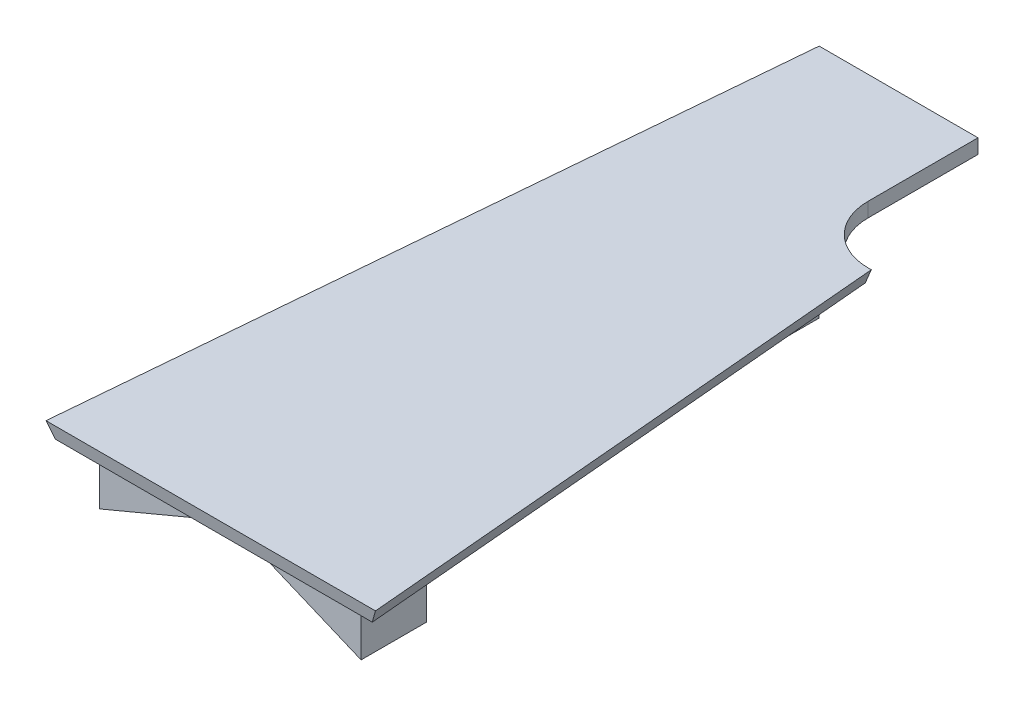
from build123d import *

# Parameters (mm, degrees)
SKIZZE1_W                            = 57
SKIZZE1_H                            = 123
AUFSATZ_LINEAR_AUSTRAGEN1_DEPTH      = 2.5
SCHNITT_LINEAR_AUSTRAGEN1_DEPTH      = 84.889808678
SCHNITT_LINEAR_AUSTRAGEN2_DEPTH      = 68.828828679
SCHNITT_LINEAR_AUSTRAGEN3_DEPTH      = 70.726045338
SCHNITT_LINEAR_AUSTRAGEN3_DEPTH_BACK = 70.726045338
SCHNITT_LINEAR_AUSTRAGEN4_DEPTH      = 70.47454308
SCHNITT_LINEAR_AUSTRAGEN4_DEPTH_BACK = 70.47454308
SKIZZE9_W                            = 45.241474544
SKIZZE9_H                            = 11.280630507
AUFSATZ_LINEAR_AUSTRAGEN2_DEPTH      = 13
SCHNITT_LINEAR_AUSTRAGEN5_DEPTH      = 20
SKIZZE12_W                           = 36.023643564
SKIZZE12_H                           = 10.472363364
AUFSATZ_LINEAR_AUSTRAGEN3_DEPTH      = 5
SCHNITT_LINEAR_AUSTRAGEN6_DEPTH      = 12
SCHNITT_LINEAR_AUSTRAGEN8_DEPTH      = 0.5
SCHNITT_LINEAR_AUSTRAGEN8_DEPTH_BACK = 1.65
SKIZZE16_R                           = 3.1
SCHNITT_LINEAR_AUSTRAGEN9_DEPTH      = 1.15
SCHNITT_LINEAR_AUSTRAGEN9_DEPTH_BACK = 1
SKIZZE17_R                           = 3.1
SCHNITT_LINEAR_AUSTRAGEN10_DEPTH     = 10


with BuildPart() as part:
    # Skizze1 → Aufsatz-Linear austragen1 (new body)
    with BuildSketch(Plane(origin=(0, 0, 0), x_dir=(1, 0, 0), z_dir=(0, 1, 0))):
        Rectangle(SKIZZE1_W, SKIZZE1_H)
    extrude(amount=AUFSATZ_LINEAR_AUSTRAGEN1_DEPTH)

    # Skizze2 → Schnitt-Linear austragen1 (cut, through all)
    with BuildSketch(Plane(origin=(28.5, 0, 0), x_dir=(0, 0, -1), z_dir=(1, 0, 0))):
        Polygon((-61.5, 2.5), (-61.5, 0), (-60.968608596, 0), align=None)
    extrude(amount=-SCHNITT_LINEAR_AUSTRAGEN1_DEPTH, mode=Mode.SUBTRACT)

    # Skizze3 → Schnitt-Linear austragen2 (cut, through all)
    with BuildSketch(Plane(origin=(0, 2.5, 0), x_dir=(1, 0, 0), z_dir=(0, 1, 0))):
        Polygon((-28.5, -61.5), (-17.738894386, 61.5), (-28.5, 61.5), align=None)
        Polygon((28.5, -61.5), (17.738894386, 61.5), (28.5, 61.5), align=None)
    extrude(amount=-SCHNITT_LINEAR_AUSTRAGEN2_DEPTH, mode=Mode.SUBTRACT)

    # Skizze5 → Schnitt-Linear austragen3 (cut, two sides: drawn at the far end of the back side and taken through both)
    with BuildSketch(Plane(origin=(0.175618176, 0, 2.007324937), x_dir=(0, -1, 0), z_dir=(0.08715574274765484, 0, 0.9961946980917459)).offset(-SCHNITT_LINEAR_AUSTRAGEN3_DEPTH_BACK)):
        Polygon((0.008562414, 23.031470717), (-2.5, 23.031470717), (0, 21.995936811), align=None)
    extrude(amount=SCHNITT_LINEAR_AUSTRAGEN3_DEPTH + SCHNITT_LINEAR_AUSTRAGEN3_DEPTH_BACK, mode=Mode.SUBTRACT)

    # Skizze6 → Schnitt-Linear austragen4 (cut, two sides: drawn at the far end of the back side and taken through both)
    with BuildSketch(Plane(origin=(-0.152372814, 0, 1.741629235), x_dir=(0, 1, 0), z_dir=(-0.08715574274766175, 0, 0.9961946980917452)).offset(-SCHNITT_LINEAR_AUSTRAGEN4_DEPTH_BACK)):
        Polygon((2.5, 23.031470717), (0, 21.995936811), (0, 23.031470717), align=None)
    extrude(amount=SCHNITT_LINEAR_AUSTRAGEN4_DEPTH + SCHNITT_LINEAR_AUSTRAGEN4_DEPTH_BACK, mode=Mode.SUBTRACT)

    # Skizze9 → Aufsatz-Linear austragen2 (add)
    with BuildSketch(Plane.XZ):
        with Locations((0, 52.468608596)):
            Rectangle(SKIZZE9_W, SKIZZE9_H)
    extrude(amount=AUFSATZ_LINEAR_AUSTRAGEN2_DEPTH)

    # Skizze11 → Schnitt-Linear austragen5 (cut)
    with BuildSketch(Plane(origin=(0, 0, 46.828293342), x_dir=(-1, 0, 0), z_dir=(0, 0, -1))):
        Polygon((-22.620737272, -9.484039906), (0, 0), (22.620737272, -9.484039906), (22.620737272, -13), (-22.620737272, -13), align=None)
    extrude(amount=-SCHNITT_LINEAR_AUSTRAGEN5_DEPTH, mode=Mode.SUBTRACT)

    # Skizze12 → Aufsatz-Linear austragen3 (add)
    with BuildSketch(Plane.XZ):
        with Locations((0, -20.5)):
            Rectangle(SKIZZE12_W, SKIZZE12_H)
    extrude(amount=AUFSATZ_LINEAR_AUSTRAGEN3_DEPTH)

    # Skizze13 → Schnitt-Linear austragen6 (cut)
    with BuildSketch(Plane(origin=(0, 0, -25.736181682), x_dir=(-1, 0, 0), z_dir=(0, 0, -1))):
        Polygon((-18.011821782, -2.5), (-7.183132097, 0), (7.183132097, 0), (18.011821782, -2.5), (18.011821782, -5), (-18.011821782, -5), align=None)
    extrude(amount=-SCHNITT_LINEAR_AUSTRAGEN6_DEPTH, mode=Mode.SUBTRACT)

    # Skizze16 → Schnitt-Linear austragen8 (cut, two sides: drawn at the far end of the back side and taken through both)
    with BuildSketch(Plane.XZ.offset(-SCHNITT_LINEAR_AUSTRAGEN8_DEPTH_BACK)):
        with Locations((12.59747694, -20.5)):
            Circle(SKIZZE16_R)
        with Locations((-12.59747694, -20.5)):
            Circle(SKIZZE16_R)
    extrude(amount=SCHNITT_LINEAR_AUSTRAGEN8_DEPTH + SCHNITT_LINEAR_AUSTRAGEN8_DEPTH_BACK, mode=Mode.SUBTRACT)

    # Skizze17 → Schnitt-Linear austragen9 (cut, two sides: drawn at the far end of the back side and taken through both)
    with BuildSketch(Plane(origin=(0, -4.742019953, 0), x_dir=(1, 0, 0), z_dir=(0, 1, 0)).offset(-SCHNITT_LINEAR_AUSTRAGEN9_DEPTH_BACK)):
        with Locations((-16.965552954, -52.468608596)):
            Circle(SKIZZE17_R)
        with Locations((16.965552954, -52.468608596)):
            Circle(SKIZZE17_R)
    extrude(amount=SCHNITT_LINEAR_AUSTRAGEN9_DEPTH + SCHNITT_LINEAR_AUSTRAGEN9_DEPTH_BACK, mode=Mode.SUBTRACT)

    # Skizze18 → Schnitt-Linear austragen10 (cut)
    with BuildSketch(Plane(origin=(0, 2.5, 0), x_dir=(1, 0, 0), z_dir=(0, 1, 0))):
        with BuildLine():
            Line((17.738894386, 61.5), (9.738894386, 61.5))
            Line((9.738894386, 61.5), (9.738894386, 42.5))
            Line((9.738894386, 42.5), (9.738894386, 42.494341137))
            ThreePointArc((9.738894386, 42.494341137), (12.722062254, 35.369450483), (19.891707751, 32.495508801))
            Line((19.891707751, 32.495508801), (20.275944794, 32.501381142))
            Line((20.275944794, 32.501381142), (17.738894386, 61.5))
        make_face()
    extrude(amount=-SCHNITT_LINEAR_AUSTRAGEN10_DEPTH, mode=Mode.SUBTRACT)


solid = part.part
